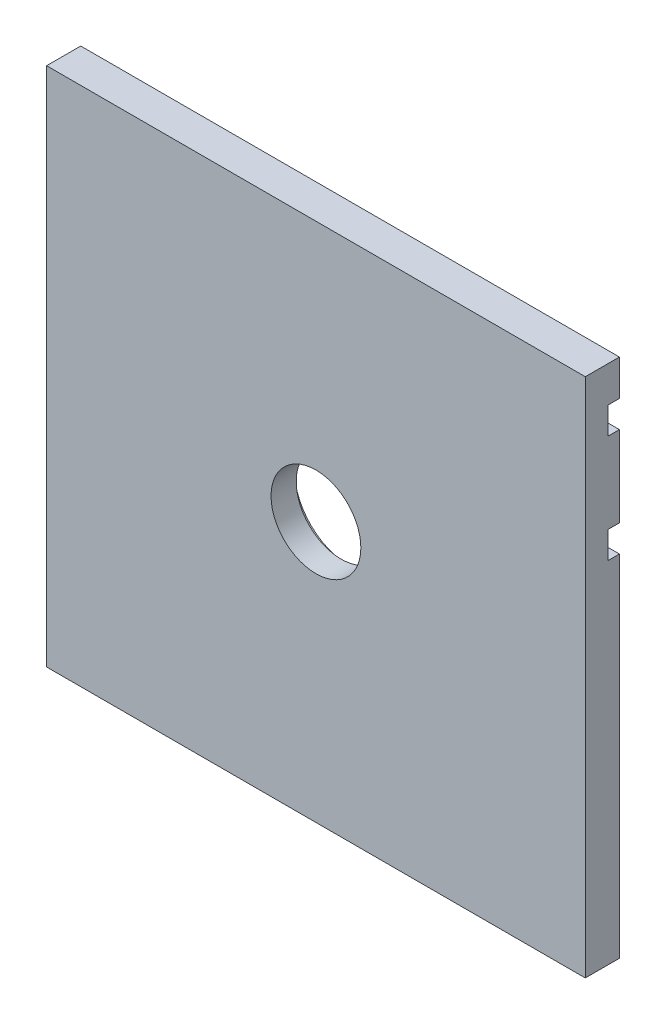
from build123d import *

# Parameters (mm, degrees)
ESQUISSE1_W                  = 600
ESQUISSE1_H                  = 580
BOSS_EXTRU_1_DEPTH           = 38
ENL_V_MAT_EXTRU_1_DEPTH      = 836.370576451
ENL_V_MAT_EXTRU_1_DEPTH_BACK = 836.370576451
ESQUISSE2_R                  = 50
ESQUISSE3_R                  = 62
ENL_V_MAT_EXTRU_3_DEPTH      = 10
ESQUISSE4_W                  = 600
ESQUISSE4_H                  = 30
ENL_V_MAT_EXTRU_4_DEPTH      = 12.8
ESQUISSE5_W                  = 30
ESQUISSE5_H                  = 280
ENL_V_MAT_EXTRU_5_DEPTH      = 12.8


with BuildPart() as part:
    # Esquisse1 → Boss.-Extru.1 (new body)
    with BuildSketch(Plane.XY):
        with Locations((300, 290)):
            Rectangle(ESQUISSE1_W, ESQUISSE1_H)
    extrude(amount=BOSS_EXTRU_1_DEPTH)

    # Esquisse2 → Enlèv. mat.-Extru.1 (cut, two sides: drawn at the far end of the back side and taken through both)
    with BuildSketch(Plane.XY.offset(38).offset(-ENL_V_MAT_EXTRU_1_DEPTH_BACK)):
        with Locations((300, 290)):
            Circle(ESQUISSE2_R)
    extrude(amount=ENL_V_MAT_EXTRU_1_DEPTH + ENL_V_MAT_EXTRU_1_DEPTH_BACK, mode=Mode.SUBTRACT)

    # Esquisse3 → Enlèv. mat.-Extru.3 (cut)
    with BuildSketch(Plane.XY):
        with Locations((300, 290)):
            Circle(ESQUISSE3_R)
    extrude(amount=ENL_V_MAT_EXTRU_3_DEPTH, mode=Mode.SUBTRACT)

    # Esquisse4 → Enlèv. mat.-Extru.4 (cut)
    with BuildSketch(Plane(origin=(0, 0, 0), x_dir=(-1, 0, 0), z_dir=(0, 0, -1))):
        with Locations((-300, 405)):
            Rectangle(ESQUISSE4_W, ESQUISSE4_H)
        with Locations((-300, 525)):
            Rectangle(ESQUISSE4_W, ESQUISSE4_H)
    extrude(amount=-ENL_V_MAT_EXTRU_4_DEPTH, mode=Mode.SUBTRACT)

    # Esquisse5 → Enlèv. mat.-Extru.5 (cut)
    with BuildSketch(Plane(origin=(0, 0, 0), x_dir=(-1, 0, 0), z_dir=(0, 0, -1))):
        with Locations((-65, 140)):
            Rectangle(ESQUISSE5_W, ESQUISSE5_H)
        with Locations((-535, 140)):
            Rectangle(ESQUISSE5_W, ESQUISSE5_H)
    extrude(amount=-ENL_V_MAT_EXTRU_5_DEPTH, mode=Mode.SUBTRACT)


solid = part.part
